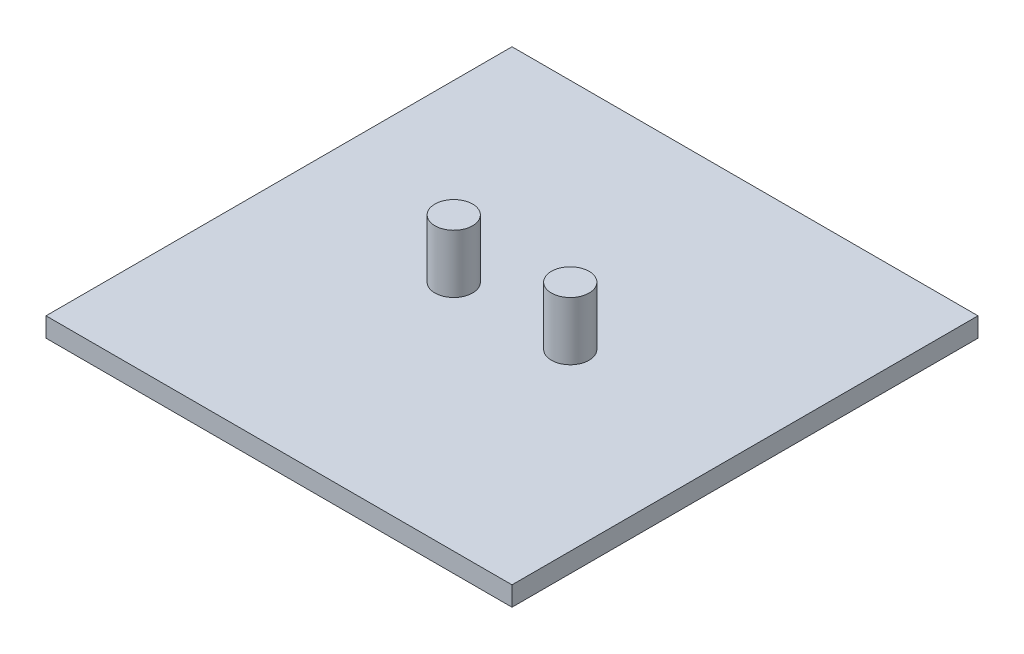
from build123d import *

# Parameters (mm, degrees)
SKETCH1_R             = 2.425
BOSS_EXTRUDE1_DEPTH   = 7.5
BOSS_EXTRUDE1_2_DEPTH = 7.5
SKETCH2_W             = 60
SKETCH2_H             = 60
BOSS_EXTRUDE2_DEPTH   = 2.5


with BuildPart() as part:
    # Sketch1 → Boss-Extrude1 (new body)
    with BuildSketch(Plane(origin=(0, 0, 0), x_dir=(1, 0, 0), z_dir=(0, 1, 0))):
        with Locations(Location((-7.5, 0, 0), (0, 0, 270))):
            Circle(SKETCH1_R)
    extrude(amount=BOSS_EXTRUDE1_DEPTH)



with BuildPart() as body_2:
    # Sketch1 → Boss-Extrude1 2 (new body)
    with BuildSketch(Plane(origin=(0, 0, 0), x_dir=(1, 0, 0), z_dir=(0, 1, 0))):
        with Locations(Location((7.5, 0, 0), (0, 0, 270))):
            Circle(SKETCH1_R)
    extrude(amount=BOSS_EXTRUDE1_2_DEPTH)


with BuildPart() as part_1:
    add(part.part)

    add(body_2.part)  # Boss-Extrude2 merges body 2
    # Sketch2 → Boss-Extrude2 (add)
    with BuildSketch(Plane(origin=(0, 0, 0), x_dir=(1, 0, 0), z_dir=(0, 1, 0))):
        Rectangle(SKETCH2_W, SKETCH2_H)
    extrude(amount=-BOSS_EXTRUDE2_DEPTH)


solid = part_1.part
